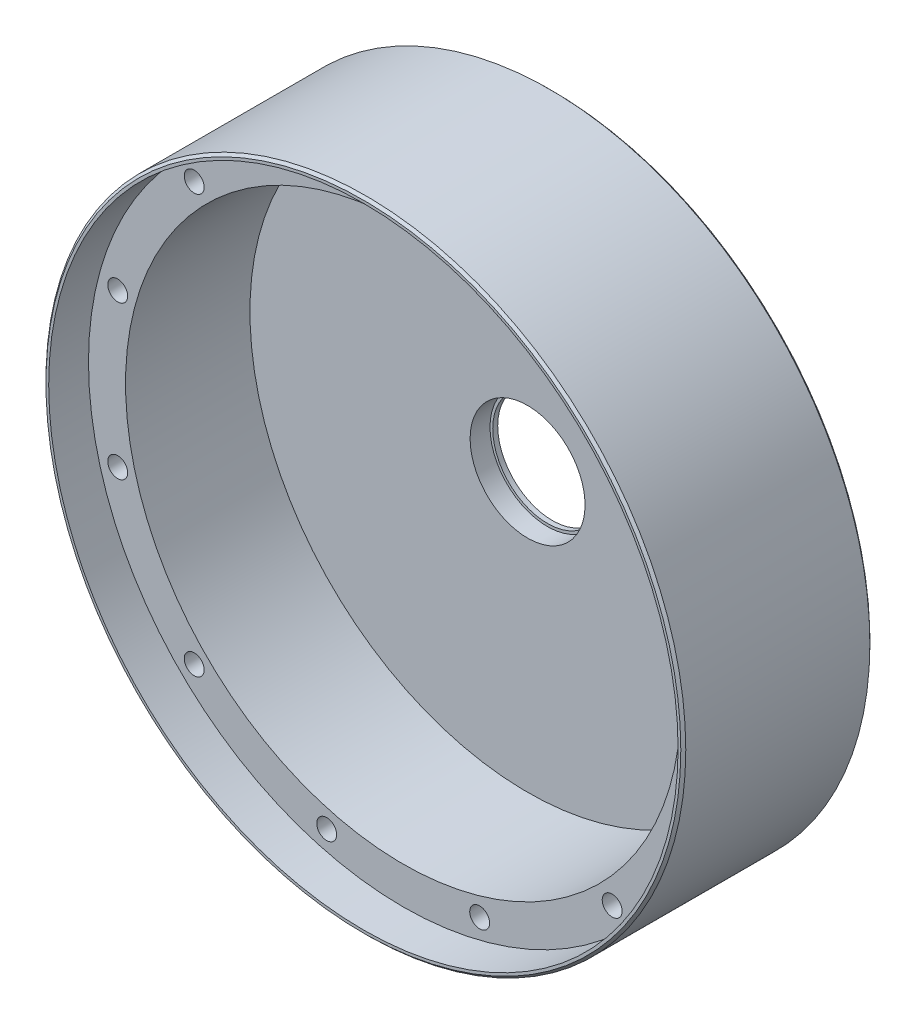
from build123d import *

# Parameters (mm, degrees)
ACTUATOR_HOUSING_MOUNT_R    = 64.3
ACTUATOR_HOUSING_MOUNT_R_2  = 55.8
ACTUATOR_HOUSING_MOUNT_R_3  = 1.55
ACTUATOR_HOUSING_WALL_DEPTH = 25
SKETCH2_R                   = 64.3
SKETCH2_R_2                 = 1.55
SKETCH2_R_3                 = 55.8
BOSS_EXTRUDE2_DEPTH         = 5
CUT_EXTRUDE1_START          = -5
SKETCH3_R                   = 11.55
CUT_EXTRUDE1_DEPTH          = 4
SKETCH4_R                   = 11
CUT_EXTRUDE2_DEPTH          = 4
BOSS_EXTRUDE3_START         = 8
SKETCH6_R                   = 64.3
SKETCH6_R_2                 = 63.25
BOSS_EXTRUDE3_DEPTH         = 8
SKETCH7_R                   = 2
M3_INSERT_L12_DEPTH         = 12
CHAMFER2_SIZE               = 0.5


with BuildPart() as part:
    # Actuator Housing Mount → Actuator Housing Wall (new body)
    with BuildSketch(Plane.XY.offset(19)):
        Circle(ACTUATOR_HOUSING_MOUNT_R)
        Circle(ACTUATOR_HOUSING_MOUNT_R_2, mode=Mode.SUBTRACT)
        with Locations((57.375994082, 15.373851279)):
            Circle(ACTUATOR_HOUSING_MOUNT_R_3, mode=Mode.SUBTRACT)
        with Locations((57.375994082, -15.373851279)):
            Circle(ACTUATOR_HOUSING_MOUNT_R_3, mode=Mode.SUBTRACT)
        with Locations((42.002142802, -42.002142802)):
            Circle(ACTUATOR_HOUSING_MOUNT_R_3, mode=Mode.SUBTRACT)
        with Locations((15.373851279, -57.375994082)):
            Circle(ACTUATOR_HOUSING_MOUNT_R_3, mode=Mode.SUBTRACT)
        with Locations((-15.373851279, -57.375994082)):
            Circle(ACTUATOR_HOUSING_MOUNT_R_3, mode=Mode.SUBTRACT)
        with Locations((-42.002142802, -42.002142802)):
            Circle(ACTUATOR_HOUSING_MOUNT_R_3, mode=Mode.SUBTRACT)
        with Locations((-57.375994082, -15.373851279)):
            Circle(ACTUATOR_HOUSING_MOUNT_R_3, mode=Mode.SUBTRACT)
        with Locations((-57.375994082, 15.373851279)):
            Circle(ACTUATOR_HOUSING_MOUNT_R_3, mode=Mode.SUBTRACT)
        with Locations((-42.002142802, 42.002142802)):
            Circle(ACTUATOR_HOUSING_MOUNT_R_3, mode=Mode.SUBTRACT)
        with Locations((-15.373851279, 57.375994082)):
            Circle(ACTUATOR_HOUSING_MOUNT_R_3, mode=Mode.SUBTRACT)
        with Locations((15.373851279, 57.375994082)):
            Circle(ACTUATOR_HOUSING_MOUNT_R_3, mode=Mode.SUBTRACT)
        with Locations((42.002142802, 42.002142802)):
            Circle(ACTUATOR_HOUSING_MOUNT_R_3, mode=Mode.SUBTRACT)
    extrude(amount=-ACTUATOR_HOUSING_WALL_DEPTH)

    # Sketch2 → Boss-Extrude2 (add)
    # profile 1 of 2: a face of its own
    with BuildSketch(Plane(origin=(0, 0, -6), x_dir=(-1, 0, 0), z_dir=(0, 0, -1))):
        with Locations(Location((0, 0, 0), (0, 0, 180))):
            Circle(SKETCH2_R)
        with Locations(Location((-15.373851279, 57.375994082, 0), (0, 0, 180))):
            Circle(SKETCH2_R_2, mode=Mode.SUBTRACT)
        with Locations(Location((42.002142802, 42.002142802, 0), (0, 0, 180))):
            Circle(SKETCH2_R_2, mode=Mode.SUBTRACT)
        with Locations(Location((57.375994082, -15.373851279, 0), (0, 0, 180))):
            Circle(SKETCH2_R_2, mode=Mode.SUBTRACT)
        with Locations(Location((15.373851279, -57.375994082, 0), (0, 0, 180))):
            Circle(SKETCH2_R_2, mode=Mode.SUBTRACT)
        with Locations(Location((-42.002142802, -42.002142802, 0), (0, 0, 180))):
            Circle(SKETCH2_R_2, mode=Mode.SUBTRACT)
        with Locations(Location((-57.375994082, -15.373851279, 0), (0, 0, 180))):
            Circle(SKETCH2_R_2, mode=Mode.SUBTRACT)
        with Locations(Location((-57.375994082, 15.373851279, 0), (0, 0, 180))):
            Circle(SKETCH2_R_2, mode=Mode.SUBTRACT)
        with Locations(Location((0, 0, 0), (0, 0, 180))):
            Circle(SKETCH2_R_3, mode=Mode.SUBTRACT)
        with Locations(Location((-15.373851279, -57.375994082, 0), (0, 0, 180))):
            Circle(SKETCH2_R_2, mode=Mode.SUBTRACT)
        with Locations(Location((42.002142802, -42.002142802, 0), (0, 0, 180))):
            Circle(SKETCH2_R_2, mode=Mode.SUBTRACT)
        with Locations(Location((57.375994082, 15.373851279, 0), (0, 0, 180))):
            Circle(SKETCH2_R_2, mode=Mode.SUBTRACT)
        with Locations(Location((15.373851279, 57.375994082, 0), (0, 0, 180))):
            Circle(SKETCH2_R_2, mode=Mode.SUBTRACT)
        with Locations(Location((-42.002142802, 42.002142802, 0), (0, 0, 180))):
            Circle(SKETCH2_R_2, mode=Mode.SUBTRACT)
    # profile 2 of 2: a face of its own
    with BuildSketch(Plane(origin=(0, 0, -6), x_dir=(-1, 0, 0), z_dir=(0, 0, -1))):
        with Locations(Location((0, 0, 0), (0, 0, 180))):
            Circle(SKETCH2_R_3)
    extrude(amount=BOSS_EXTRUDE2_DEPTH)

    # Sketch3 → Cut-Extrude1 (cut)
    with BuildSketch(Plane(origin=(0, 0, -11), x_dir=(-1, 0, 0), z_dir=(0, 0, -1)).offset(CUT_EXTRUDE1_START)):
        Circle(SKETCH3_R)
    extrude(amount=CUT_EXTRUDE1_DEPTH, mode=Mode.SUBTRACT)

    # Sketch4 → Cut-Extrude2 (cut)
    with BuildSketch(Plane(origin=(0, 0, -11), x_dir=(-1, 0, 0), z_dir=(0, 0, -1))):
        Circle(SKETCH4_R)
    extrude(amount=-CUT_EXTRUDE2_DEPTH, mode=Mode.SUBTRACT)

    # Sketch6 → Boss-Extrude3 (add)
    with BuildSketch(Plane.XY.offset(19).offset(BOSS_EXTRUDE3_START)):
        Circle(SKETCH6_R)
        Circle(SKETCH6_R_2, mode=Mode.SUBTRACT)
    extrude(amount=-BOSS_EXTRUDE3_DEPTH)

    # Sketch7 → M3 Insert L12 (cut)
    with BuildSketch(Plane.XY.offset(19)):
        with Locations((57.375994082, -15.373851279)):
            Circle(SKETCH7_R)
        with Locations((42.002142802, -42.002142802)):
            Circle(SKETCH7_R)
        with Locations((15.373851279, -57.375994082)):
            Circle(SKETCH7_R)
        with Locations((-15.373851279, -57.375994082)):
            Circle(SKETCH7_R)
        with Locations((-42.002142802, -42.002142802)):
            Circle(SKETCH7_R)
        with Locations((-57.375994082, -15.373851279)):
            Circle(SKETCH7_R)
        with Locations((-57.375994082, 15.373851279)):
            Circle(SKETCH7_R)
        with Locations((-42.002142802, 42.002142802)):
            Circle(SKETCH7_R)
        with Locations((-15.373851279, 57.375994082)):
            Circle(SKETCH7_R)
        with Locations((15.373851279, 57.375994082)):
            Circle(SKETCH7_R)
        with Locations((42.002142802, 42.002142802)):
            Circle(SKETCH7_R)
        with Locations((57.375994082, 15.373851279)):
            Circle(SKETCH7_R)
    extrude(amount=-M3_INSERT_L12_DEPTH, mode=Mode.SUBTRACT)

    # Chamfer2
    chamfer2_edges = [part.edges().sort_by_distance(p)[0] for p in [
        (-64.3, 0, 27),
        (-64.3, 0, -11),
    ]]
    chamfer(chamfer2_edges, length=CHAMFER2_SIZE)


solid = part.part
